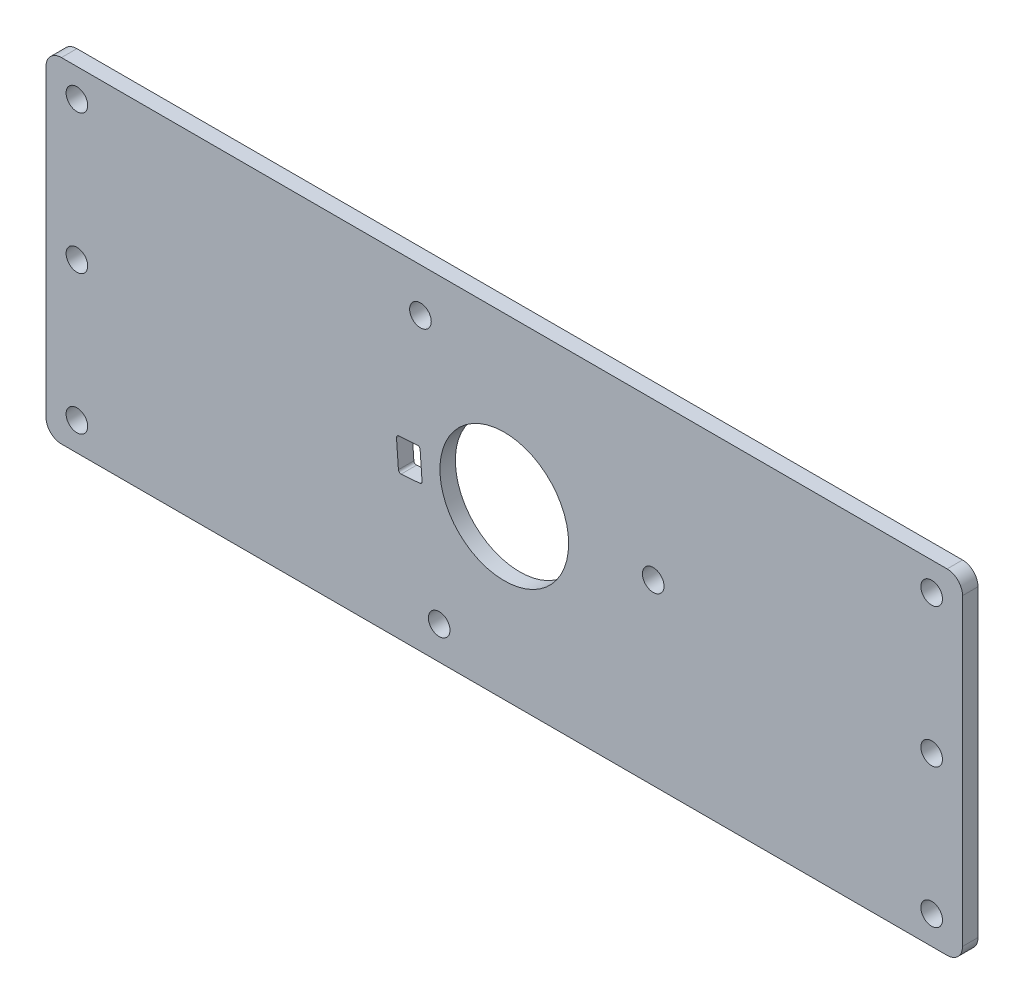
from build123d import *

# Parameters (mm, degrees)
SKETCH_1_W          = 178
SKETCH_1_H          = 65
EXTRUDE_1_DEPTH     = 3
FILLET_1_R          = 3
SKETCH_2_R          = 2.1
SKETCH_2_R_2        = 12.5
SKETCH_2_R_3        = 11
SKETCH_2_R_4        = 1.8
CUT_EXTRUDE_1_DEPTH = 10


with BuildPart() as part:
    # 草图1 → 凸台-拉伸1 (new body)
    with BuildSketch(Plane.XY):
        Rectangle(SKETCH_1_W, SKETCH_1_H)
    extrude(amount=EXTRUDE_1_DEPTH)

    # 圆角1
    fillet_1_edges = [part.edges().sort_by_distance(p)[0] for p in [
        (-89, 32.5, 1.5),
        (89, 32.5, 1.5),
        (89, -32.5, 1.5),
        (-89, -32.5, 1.5),
    ]]
    fillet(fillet_1_edges, radius=FILLET_1_R)

    # 草图2 → 切除-拉伸1 (cut)
    # profile 1 of 14: a face of its own
    with BuildSketch(Plane.XY.offset(3)):
        with Locations((-83, 27)):
            Circle(SKETCH_2_R)
    # profile 2 of 14: a face of its own
    with BuildSketch(Plane.XY.offset(3)):
        with Locations((-83, 0)):
            Circle(SKETCH_2_R)
    # profile 3 of 14: a face of its own
    with BuildSketch(Plane.XY.offset(3)):
        with Locations((-83, -27)):
            Circle(SKETCH_2_R)
    # profile 4 of 14: a face of its own
    with BuildSketch(Plane.XY.offset(3)):
        Circle(SKETCH_2_R_2)
        Circle(SKETCH_2_R_3, mode=Mode.SUBTRACT)
    # profile 5 of 14: a face of its own
    with BuildSketch(Plane.XY.offset(3)):
        Circle(SKETCH_2_R_3)
    # profile 6 of 14: a face of its own
    with BuildSketch(Plane.XY.offset(3)):
        with Locations((-16.280586137, 23.998802367)):
            Circle(SKETCH_2_R)
        with Locations((-16.280586137, 23.998802367)):
            Circle(SKETCH_2_R_4, mode=Mode.SUBTRACT)
    # profile 7 of 14: a face of its own
    with BuildSketch(Plane.XY.offset(3)):
        with Locations((-16.280586137, 23.998802367)):
            Circle(SKETCH_2_R_4)
    # profile 8 of 14: a face of its own
    with BuildSketch(Plane.XY.offset(3)):
        with Locations((28.923865578, 2.1)):
            Circle(SKETCH_2_R)
        with Locations((28.923865578, 2.1)):
            Circle(SKETCH_2_R_4, mode=Mode.SUBTRACT)
    # profile 9 of 14: a face of its own
    with BuildSketch(Plane.XY.offset(3)):
        with Locations((28.923865578, 2.1)):
            Circle(SKETCH_2_R_4)
    # profile 10 of 14: a face of its own
    with BuildSketch(Plane.XY.offset(3)):
        with Locations((-12.643279441, -26.098802367)):
            Circle(SKETCH_2_R)
    # profile 11 of 14: a face of its own
    with BuildSketch(Plane.XY.offset(3)):
        with BuildLine():
            Line((-15.969193875, -3.766277604), (-16.345745599, 1.420070707))
            ThreePointArc((-16.345745599, 1.420070707), (-16.372108992, 1.547906767), (-16.430660482, 1.664563571))
            ThreePointArc((-16.430660482, 1.664563571), (-16.62644536, 1.833843162), (-16.880639833, 1.882551148))
            Line((-16.880639833, 1.882551148), (-20.471188664, 1.621861493))
            ThreePointArc((-20.471188664, 1.621861493), (-20.813209107, 1.450197211), (-20.933669105, 1.086967259))
            Line((-20.933669105, 1.086967259), (-20.55711738, -4.099381052))
            ThreePointArc((-20.55711738, -4.099381052), (-20.385453099, -4.441401495), (-20.022223146, -4.561861493))
            Line((-20.022223146, -4.561861493), (-16.431674316, -4.301171838))
            ThreePointArc((-16.431674316, -4.301171838), (-16.089653872, -4.129507556), (-15.969193875, -3.766277604))
        make_face()
    # profile 12 of 14: a face of its own
    with BuildSketch(Plane.XY.offset(3)):
        with Locations((83, 27)):
            Circle(SKETCH_2_R)
    # profile 13 of 14: a face of its own
    with BuildSketch(Plane.XY.offset(3)):
        with Locations((83, 0)):
            Circle(SKETCH_2_R)
    # profile 14 of 14: a face of its own
    with BuildSketch(Plane.XY.offset(3)):
        with Locations((83, -27)):
            Circle(SKETCH_2_R)
    extrude(amount=-CUT_EXTRUDE_1_DEPTH, mode=Mode.SUBTRACT)


solid = part.part
